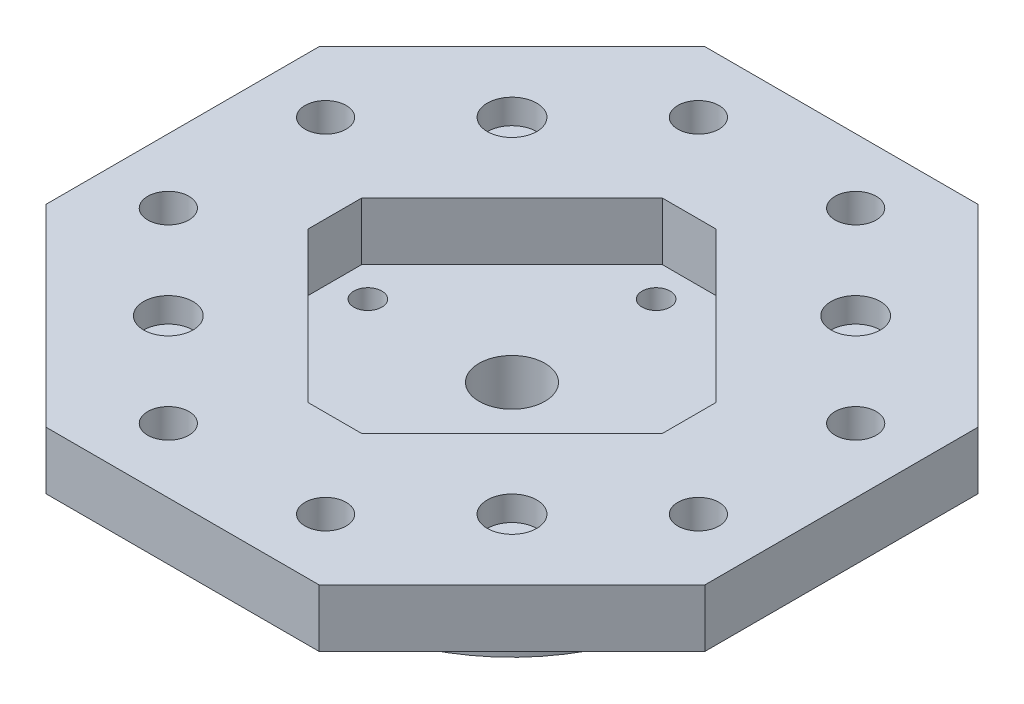
from build123d import *

# Parameters (mm, degrees)
SKETCH_1_R          = 27.5
EXTRUDE_1_DEPTH     = 3
SKETCH_2_R          = 22.5
EXTRUDE_2_DEPTH     = 10
CUT_EXTRUDE_1_REACH = 43.006
SKETCH_3_R          = 1.7
SKETCH_3_R_2        = 4
EXTRUDE_3_DEPTH     = 7
SKETCH_6_R          = 3
CUT_EXTRUDE_2_DEPTH = 3
CUT_EXTRUDE_3_REACH = 62
SKETCH_7_R          = 2.5


with BuildPart() as part:
    # 草图1 → 凸台-拉伸1 (new body)
    with BuildSketch(Plane(origin=(0, 0, 0), x_dir=(1, 0, 0), z_dir=(0, 1, 0))):
        with Locations(Location((0, 0, 0), (0, 0, 270))):
            Circle(SKETCH_1_R)
    extrude(amount=-EXTRUDE_1_DEPTH)

    # 草图2 → 凸台-拉伸2 (add)
    with BuildSketch(Plane.XZ.offset(3)):
        with Locations(Location((0, 0, 0), (0, 0, 270))):
            Circle(SKETCH_2_R)
    extrude(amount=EXTRUDE_2_DEPTH)

    # 草图3 → 切除-拉伸1 (cut, up to next)
    with BuildSketch(Plane.XZ.offset(13), mode=Mode.PRIVATE) as cut_extrude_1_sk1:
        with Locations(Location((0, 17.5, 0), (0, 0, 270))):
            Circle(SKETCH_3_R)
    cut_extrude_1_tool1 = extrude(cut_extrude_1_sk1.sketch, amount=-CUT_EXTRUDE_1_REACH, mode=Mode.PRIVATE) & part.part
    # 草图3 → 切除-拉伸1 (cut, up to next)
    with BuildSketch(Plane.XZ.offset(13), mode=Mode.PRIVATE) as cut_extrude_1_sk2:
        with Locations(Location((17.5, 0, 0), (0, 0, 270))):
            Circle(SKETCH_3_R)
    cut_extrude_1_tool2 = extrude(cut_extrude_1_sk2.sketch, amount=-CUT_EXTRUDE_1_REACH, mode=Mode.PRIVATE) & part.part
    # 草图3 → 切除-拉伸1 (cut, up to next)
    with BuildSketch(Plane.XZ.offset(13), mode=Mode.PRIVATE) as cut_extrude_1_sk3:
        with Locations(Location((0, -17.5, 0), (0, 0, 270))):
            Circle(SKETCH_3_R)
    cut_extrude_1_tool3 = extrude(cut_extrude_1_sk3.sketch, amount=-CUT_EXTRUDE_1_REACH, mode=Mode.PRIVATE) & part.part
    # 草图3 → 切除-拉伸1 (cut, up to next)
    with BuildSketch(Plane.XZ.offset(13), mode=Mode.PRIVATE) as cut_extrude_1_sk4:
        with Locations(Location((-17.5, 0, 0), (0, 0, 270))):
            Circle(SKETCH_3_R)
    cut_extrude_1_tool4 = extrude(cut_extrude_1_sk4.sketch, amount=-CUT_EXTRUDE_1_REACH, mode=Mode.PRIVATE) & part.part
    # 草图3 → 切除-拉伸1 (cut, up to next)
    with BuildSketch(Plane.XZ.offset(13), mode=Mode.PRIVATE) as cut_extrude_1_sk5:
        with Locations(Location((0, 0, 0), (0, 0, 270))):
            Circle(SKETCH_3_R_2)
    cut_extrude_1_tool5 = extrude(cut_extrude_1_sk5.sketch, amount=-CUT_EXTRUDE_1_REACH, mode=Mode.PRIVATE) & part.part
    add(cut_extrude_1_tool1.solids().sort_by_distance((0, -13, 17.5))[0], mode=Mode.SUBTRACT)
    add(cut_extrude_1_tool2.solids().sort_by_distance((17.5, -13, 0))[0], mode=Mode.SUBTRACT)
    add(cut_extrude_1_tool3.solids().sort_by_distance((0, -13, -17.5))[0], mode=Mode.SUBTRACT)
    add(cut_extrude_1_tool4.solids().sort_by_distance((-17.5, -13, 0))[0], mode=Mode.SUBTRACT)
    add(cut_extrude_1_tool5.solids().sort_by_distance((0, -13, 0))[0], mode=Mode.SUBTRACT)

    # 草图4 → 凸台-拉伸3 (add)
    with BuildSketch(Plane(origin=(0, 0, 0), x_dir=(1, 0, 0), z_dir=(0, 1, 0))):
        Polygon((0, 40), (16.568542495, 40), (40, 16.568542495), (40, 0), (40, -16.568542495), (16.568542495, -40), (0, -40), (-16.568542495, -40), (-40, -16.568542495), (-40, 0), (-40, 16.568542495), (-16.568542495, 40), align=None)
        Polygon((0, 21.5), (3.248737342, 21.5), (21.5, 3.248737342), (21.5, 0), (21.5, -3.248737342), (3.248737342, -21.5), (0, -21.5), (-3.248737342, -21.5), (-21.5, -3.248737342), (-21.5, 0), (-21.5, 3.248737342), (-3.248737342, 21.5), align=None, mode=Mode.SUBTRACT)
    extrude(amount=EXTRUDE_3_DEPTH)

    # 草图6 → 切除-拉伸2 (cut)
    with BuildSketch(Plane(origin=(0, 7, 0), x_dir=(1, 0, 0), z_dir=(0, 1, 0))):
        with Locations(Location((20.859650045, 20.859650045, 0), (0, 0, 270))):
            Circle(SKETCH_6_R)
        with Locations(Location((20.859650045, -20.859650045, 0), (0, 0, 270))):
            Circle(SKETCH_6_R)
        with Locations(Location((-20.859650045, -20.859650045, 0), (0, 0, 270))):
            Circle(SKETCH_6_R)
        with Locations(Location((-20.859650045, 20.859650045, 0), (0, 0, 270))):
            Circle(SKETCH_6_R)
    extrude(amount=-CUT_EXTRUDE_2_DEPTH, mode=Mode.SUBTRACT)

    # 草图7 → 切除-拉伸3 (cut, up to next)
    with BuildSketch(Plane(origin=(0, 7, 0), x_dir=(1, 0, 0), z_dir=(0, 1, 0)), mode=Mode.PRIVATE) as cut_extrude_3_sk1:
        with Locations(Location((9.545941546, 32.173358544, 0), (0, 0, 270))):
            Circle(SKETCH_7_R)
    cut_extrude_3_tool1 = extrude(cut_extrude_3_sk1.sketch, amount=-CUT_EXTRUDE_3_REACH, mode=Mode.PRIVATE) & part.part
    # 草图7 → 切除-拉伸3 (cut, up to next)
    with BuildSketch(Plane(origin=(0, 7, 0), x_dir=(1, 0, 0), z_dir=(0, 1, 0)), mode=Mode.PRIVATE) as cut_extrude_3_sk2:
        with Locations(Location((32.173358544, 9.545941546, 0), (0, 0, 270))):
            Circle(SKETCH_7_R)
    cut_extrude_3_tool2 = extrude(cut_extrude_3_sk2.sketch, amount=-CUT_EXTRUDE_3_REACH, mode=Mode.PRIVATE) & part.part
    # 草图7 → 切除-拉伸3 (cut, up to next)
    with BuildSketch(Plane(origin=(0, 7, 0), x_dir=(1, 0, 0), z_dir=(0, 1, 0)), mode=Mode.PRIVATE) as cut_extrude_3_sk3:
        with Locations(Location((32.173358544, -9.545941546, 0), (0, 0, 270))):
            Circle(SKETCH_7_R)
    cut_extrude_3_tool3 = extrude(cut_extrude_3_sk3.sketch, amount=-CUT_EXTRUDE_3_REACH, mode=Mode.PRIVATE) & part.part
    # 草图7 → 切除-拉伸3 (cut, up to next)
    with BuildSketch(Plane(origin=(0, 7, 0), x_dir=(1, 0, 0), z_dir=(0, 1, 0)), mode=Mode.PRIVATE) as cut_extrude_3_sk4:
        with Locations(Location((9.545941546, -32.173358544, 0), (0, 0, 270))):
            Circle(SKETCH_7_R)
    cut_extrude_3_tool4 = extrude(cut_extrude_3_sk4.sketch, amount=-CUT_EXTRUDE_3_REACH, mode=Mode.PRIVATE) & part.part
    # 草图7 → 切除-拉伸3 (cut, up to next)
    with BuildSketch(Plane(origin=(0, 7, 0), x_dir=(1, 0, 0), z_dir=(0, 1, 0)), mode=Mode.PRIVATE) as cut_extrude_3_sk5:
        with Locations(Location((-9.545941546, -32.173358544, 0), (0, 0, 270))):
            Circle(SKETCH_7_R)
    cut_extrude_3_tool5 = extrude(cut_extrude_3_sk5.sketch, amount=-CUT_EXTRUDE_3_REACH, mode=Mode.PRIVATE) & part.part
    # 草图7 → 切除-拉伸3 (cut, up to next)
    with BuildSketch(Plane(origin=(0, 7, 0), x_dir=(1, 0, 0), z_dir=(0, 1, 0)), mode=Mode.PRIVATE) as cut_extrude_3_sk6:
        with Locations(Location((-32.173358544, -9.545941546, 0), (0, 0, 270))):
            Circle(SKETCH_7_R)
    cut_extrude_3_tool6 = extrude(cut_extrude_3_sk6.sketch, amount=-CUT_EXTRUDE_3_REACH, mode=Mode.PRIVATE) & part.part
    # 草图7 → 切除-拉伸3 (cut, up to next)
    with BuildSketch(Plane(origin=(0, 7, 0), x_dir=(1, 0, 0), z_dir=(0, 1, 0)), mode=Mode.PRIVATE) as cut_extrude_3_sk7:
        with Locations(Location((-32.173358544, 9.545941546, 0), (0, 0, 270))):
            Circle(SKETCH_7_R)
    cut_extrude_3_tool7 = extrude(cut_extrude_3_sk7.sketch, amount=-CUT_EXTRUDE_3_REACH, mode=Mode.PRIVATE) & part.part
    # 草图7 → 切除-拉伸3 (cut, up to next)
    with BuildSketch(Plane(origin=(0, 7, 0), x_dir=(1, 0, 0), z_dir=(0, 1, 0)), mode=Mode.PRIVATE) as cut_extrude_3_sk8:
        with Locations(Location((-9.545941546, 32.173358544, 0), (0, 0, 270))):
            Circle(SKETCH_7_R)
    cut_extrude_3_tool8 = extrude(cut_extrude_3_sk8.sketch, amount=-CUT_EXTRUDE_3_REACH, mode=Mode.PRIVATE) & part.part
    add(cut_extrude_3_tool1.solids().sort_by_distance((9.545942, 7, -32.173359))[0], mode=Mode.SUBTRACT)
    add(cut_extrude_3_tool2.solids().sort_by_distance((32.173359, 7, -9.545942))[0], mode=Mode.SUBTRACT)
    add(cut_extrude_3_tool3.solids().sort_by_distance((32.173359, 7, 9.545942))[0], mode=Mode.SUBTRACT)
    add(cut_extrude_3_tool4.solids().sort_by_distance((9.545942, 7, 32.173359))[0], mode=Mode.SUBTRACT)
    add(cut_extrude_3_tool5.solids().sort_by_distance((-9.545942, 7, 32.173359))[0], mode=Mode.SUBTRACT)
    add(cut_extrude_3_tool6.solids().sort_by_distance((-32.173359, 7, 9.545942))[0], mode=Mode.SUBTRACT)
    add(cut_extrude_3_tool7.solids().sort_by_distance((-32.173359, 7, -9.545942))[0], mode=Mode.SUBTRACT)
    add(cut_extrude_3_tool8.solids().sort_by_distance((-9.545942, 7, -32.173359))[0], mode=Mode.SUBTRACT)


solid = part.part
